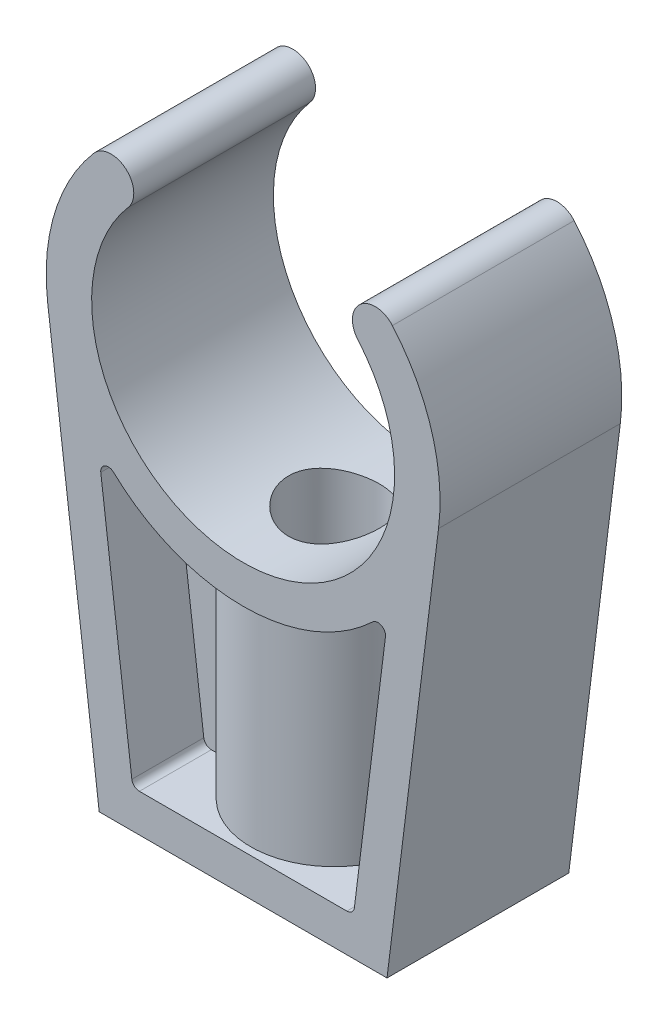
from build123d import *

# Parameters (mm, degrees)
BOSS_EXTRUDE1_DEPTH      = 6
CUT_EXTRUDE1_DEPTH       = 4.75
BOSS_EXTRUDE2_REACH      = 42.608
BOSS_EXTRUDE2_END_RADIUS = 12.5
SKETCH5_R                = 5.5
FILLET1_R                = 0.5
CUT_EXTRUDE2_DEPTH       = 5
CUT_EXTRUDE2_DEPTH_BACK  = 3
SKETCH6_R                = 3
SKETCH7_R                = 1.7
CUT_EXTRUDE3_DEPTH       = 28.342769961


with BuildPart() as part:
    # Sketch1 → Boss-Extrude1 (new, symmetric)
    with BuildSketch(Plane.XY):
        with BuildLine():
            Line((-9.5, -29), (9.5, -29))
            Line((9.5, -29), (12.900989015, -1.60140015))
            ThreePointArc((12.900989015, -1.60140015), (12.444176754, 3.760646876), (9.854901959, 8.47826087))
            ThreePointArc((9.854901959, 8.47826087), (7.739537018, 8.637104072), (7.580693815, 6.52173913))
            ThreePointArc((7.580693815, 6.52173913), (0, -10), (-7.580693815, 6.52173913))
            ThreePointArc((-7.580693815, 6.52173913), (-7.739537018, 8.637104072), (-9.854901959, 8.47826087))
            ThreePointArc((-9.854901959, 8.47826087), (-12.444176754, 3.760646876), (-12.900989015, -1.60140015))
            Line((-12.900989015, -1.60140015), (-9.5, -29))
        make_face()
    extrude(amount=BOSS_EXTRUDE1_DEPTH, both=True)

    # Sketch2 → Cut-Extrude1 (cut)
    with BuildSketch(Plane.XY.offset(6)):
        with BuildLine():
            Line((-9.5845508, -8.024112783), (-7.29113837, -26.5))
            Line((-7.29113837, -26.5), (7.29113837, -26.5))
            Line((7.29113837, -26.5), (9.5845508, -8.024112783))
            ThreePointArc((9.5845508, -8.024112783), (0, -12.5), (-9.5845508, -8.024112783))
        make_face()
    cut_extrude1 = extrude(amount=-CUT_EXTRUDE1_DEPTH, mode=Mode.SUBTRACT)

    # Mirror1: Cut-Extrude1 across plane
    add(cut_extrude1.mirror(Plane.XY), mode=Mode.SUBTRACT)

    # Boss-Extrude2: up to this cylinder (the profile starts outside it)
    boss_extrude2_end = Plane(origin=(0, 0, 0), z_dir=(0, 0, 1)) * Cylinder(BOSS_EXTRUDE2_END_RADIUS, 111.216, mode=Mode.PRIVATE)
    # Sketch5 → Boss-Extrude2 (add, up to the surface)
    with BuildSketch(Plane.XZ.offset(29), mode=Mode.PRIVATE) as boss_extrude2_sk1:
        Circle(SKETCH5_R)
    boss_extrude2_tool1 = extrude(boss_extrude2_sk1.sketch, amount=-BOSS_EXTRUDE2_REACH, mode=Mode.PRIVATE) - boss_extrude2_end
    add(boss_extrude2_tool1.solids().sort_by_distance((0, -29, 0))[0])

    # Fillet1
    fillet1_edges = [part.edges().sort_by_distance(p)[0] for p in [
        (-9.5845508, -8.024112783, 3.625),
        (9.5845508, -8.024112783, 3.625),
        (7.29113837, -26.5, 3.625),
        (-7.29113837, -26.5, 3.625),
        (9.5845508, -8.024112783, -3.625),
        (-9.5845508, -8.024112783, -3.625),
        (-7.29113837, -26.5, -3.625),
        (7.29113837, -26.5, -3.625),
    ]]
    fillet(fillet1_edges, radius=FILLET1_R)

    # Sketch6 → Cut-Extrude2 (cut, two sides: drawn at the far end of the back side and taken through both)
    with BuildSketch(Plane(origin=(0, -11.294356998, 0), x_dir=(1, 0, 0), z_dir=(0, 1, 0)).offset(-CUT_EXTRUDE2_DEPTH_BACK)):
        with Locations(Location((0, 0, 0), (0, 0, 90))):
            Circle(SKETCH6_R)
    extrude(amount=CUT_EXTRUDE2_DEPTH + CUT_EXTRUDE2_DEPTH_BACK, mode=Mode.SUBTRACT)

    # Sketch7 → Cut-Extrude3 (cut, through all)
    with BuildSketch(Plane(origin=(0, -14.294356998, 0), x_dir=(1, 0, 0), z_dir=(0, 1, 0))):
        with Locations(Location((0, 0, 0), (0, 0, 270))):
            Circle(SKETCH7_R)
    extrude(amount=-CUT_EXTRUDE3_DEPTH, mode=Mode.SUBTRACT)


solid = part.part
